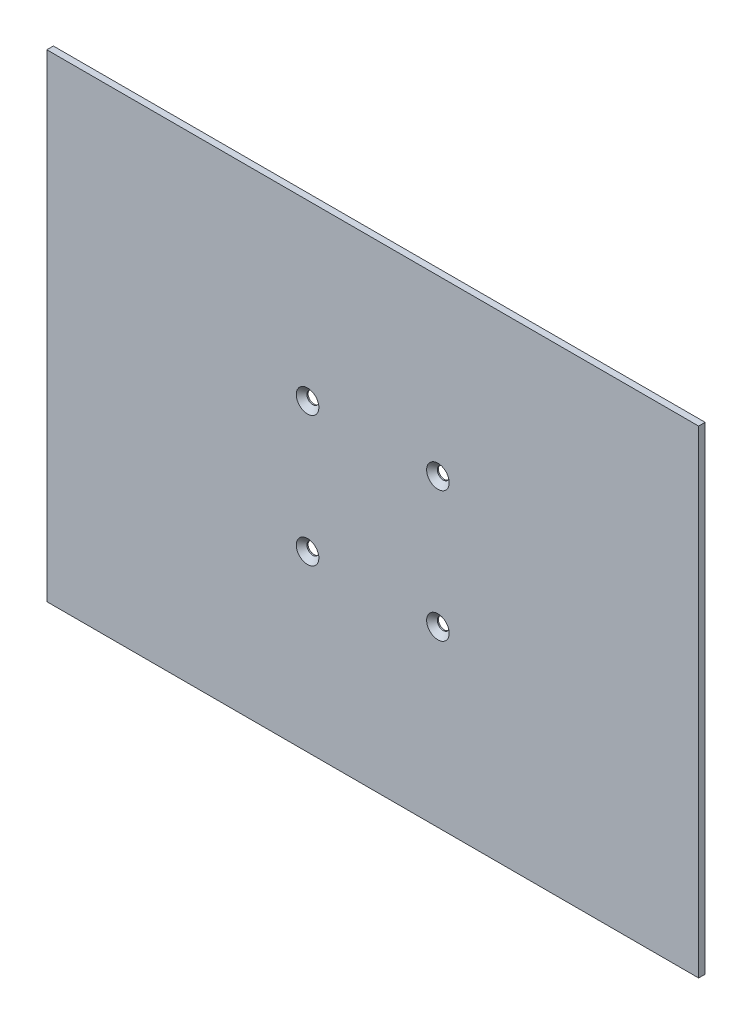
from build123d import *

# Parameters (mm, degrees)
SKETCH1_W                                   = 300
SKETCH1_H                                   = 220
BOSS_EXTRUDE1_DEPTH                         = 3
FRAISAGE_POUR_VIS_T_TE_FRAIS_E_M51_AT_COUNT = 2
FRAISAGE_POUR_VIS_T_TE_FRAIS_E_M51_AT_PITCH = 60
FRAISAGE_POUR_VIS_T_TE_FRAIS_E_M51_2_COUNT  = 2
FRAISAGE_POUR_VIS_T_TE_FRAIS_E_M51_2_PITCH  = 60
FRAISAGE_POUR_VIS_T_TE_FRAIS_E_M51_3_COUNT  = 2
FRAISAGE_POUR_VIS_T_TE_FRAIS_E_M51_3_PITCH  = 84.852813742


with BuildPart() as part:
    # Sketch1 → Boss-Extrude1 (new body)
    with BuildSketch(Plane.XY):
        Rectangle(SKETCH1_W, SKETCH1_H)
    extrude(amount=BOSS_EXTRUDE1_DEPTH)

    # Sketch5 → Fraisage pour vis à tête fraisée M51 (revolve, cut)
    with BuildSketch(Plane(origin=(-30, 30, 3), x_dir=(0, -1, 0), z_dir=(1, 0, 0))):
        Polygon((0, 0), (0, 3), (2.75, 3), (2.75, 2.45), (5.2, 0), align=None)
    fraisage_pour_vis_t_te_frais_e_m51 = revolve(axis=Axis((-30, 30, 9.35), (0, 0, -1)), mode=Mode.SUBTRACT)

    # Fraisage pour vis à tête fraisée M51 at: Fraisage pour vis à tête fraisée M51 ×2
    with Locations(*[(i * FRAISAGE_POUR_VIS_T_TE_FRAIS_E_M51_AT_PITCH, 0, 0) for i in range(1, FRAISAGE_POUR_VIS_T_TE_FRAIS_E_M51_AT_COUNT)]):
        add(fraisage_pour_vis_t_te_frais_e_m51, mode=Mode.SUBTRACT)

    # Fraisage pour vis _ t_te frais_e M51 2: Fraisage pour vis à tête fraisée M51 ×2
    with Locations(*[(0, -i * FRAISAGE_POUR_VIS_T_TE_FRAIS_E_M51_2_PITCH, 0) for i in range(1, FRAISAGE_POUR_VIS_T_TE_FRAIS_E_M51_2_COUNT)]):
        add(fraisage_pour_vis_t_te_frais_e_m51, mode=Mode.SUBTRACT)

    # Fraisage pour vis _ t_te frais_e M51 3: Fraisage pour vis à tête fraisée M51 ×2
    with Locations(*[Vector(0.7071067811865489, -0.7071067811865462, 0) * (i * FRAISAGE_POUR_VIS_T_TE_FRAIS_E_M51_3_PITCH) for i in range(1, FRAISAGE_POUR_VIS_T_TE_FRAIS_E_M51_3_COUNT)]):
        add(fraisage_pour_vis_t_te_frais_e_m51, mode=Mode.SUBTRACT)


solid = part.part
